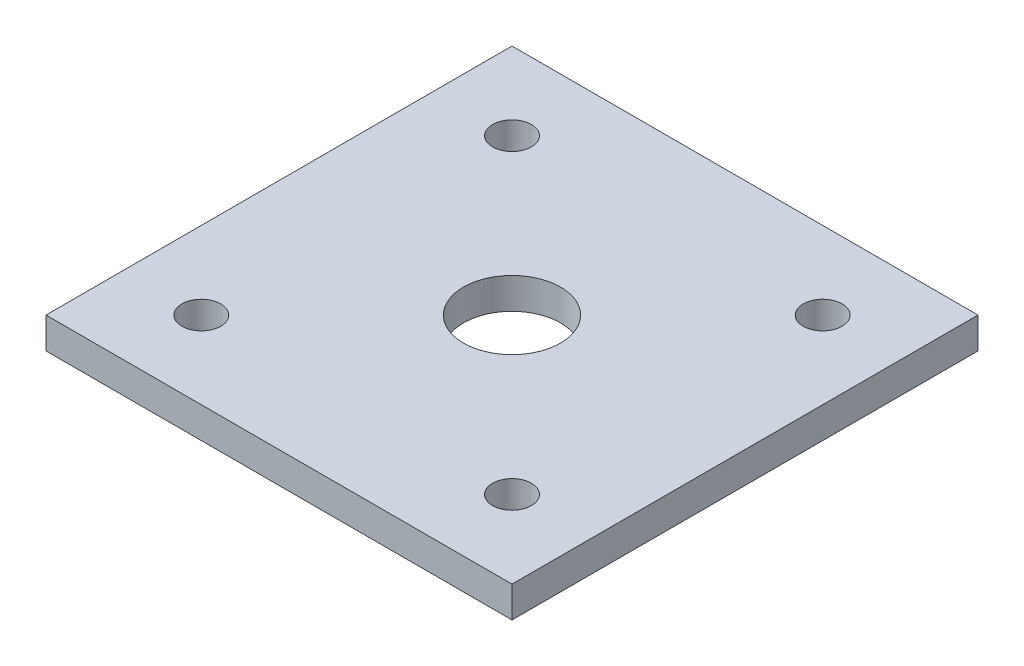
from build123d import *

# Parameters (mm, degrees)
SKETCH1_W           = 120
SKETCH1_H           = 120
BOSS_EXTRUDE1_DEPTH = 8
SKETCH2_R           = 12.5
CUT_EXTRUDE1_DEPTH  = 86.229103011
SKETCH3_R           = 5
CUT_EXTRUDE2_DEPTH  = 86.229103011
CIRPATTERN1_COUNT   = 4


with BuildPart() as part:
    # Sketch1 → Boss-Extrude1 (new body)
    with BuildSketch(Plane(origin=(0, 0, 0), x_dir=(1, 0, 0), z_dir=(0, 1, 0))):
        Rectangle(SKETCH1_W, SKETCH1_H)
    extrude(amount=BOSS_EXTRUDE1_DEPTH)

    # Sketch2 → Cut-Extrude1 (cut, through all)
    with BuildSketch(Plane(origin=(0, 8, 0), x_dir=(1, 0, 0), z_dir=(0, 1, 0))):
        with Locations(Location((0, 0, 0), (0, 0, 270))):
            Circle(SKETCH2_R)
    extrude(amount=-CUT_EXTRUDE1_DEPTH, mode=Mode.SUBTRACT)

    # Sketch3 → Cut-Extrude2 (cut, through all)
    with BuildSketch(Plane(origin=(0, 8, 0), x_dir=(1, 0, 0), z_dir=(0, 1, 0))):
        with Locations(Location((-40, 40, 0), (0, 0, 270))):
            Circle(SKETCH3_R)
    cut_extrude2 = extrude(amount=-CUT_EXTRUDE2_DEPTH, mode=Mode.SUBTRACT)

    # CirPattern1: Cut-Extrude2 ×4 about axis
    cirpattern1_axis = Axis((0, 0, 0), (0, 1, 0))
    for i in range(1, CIRPATTERN1_COUNT):
        add(cut_extrude2.rotate(cirpattern1_axis, i * 360 / CIRPATTERN1_COUNT), mode=Mode.SUBTRACT)


solid = part.part
